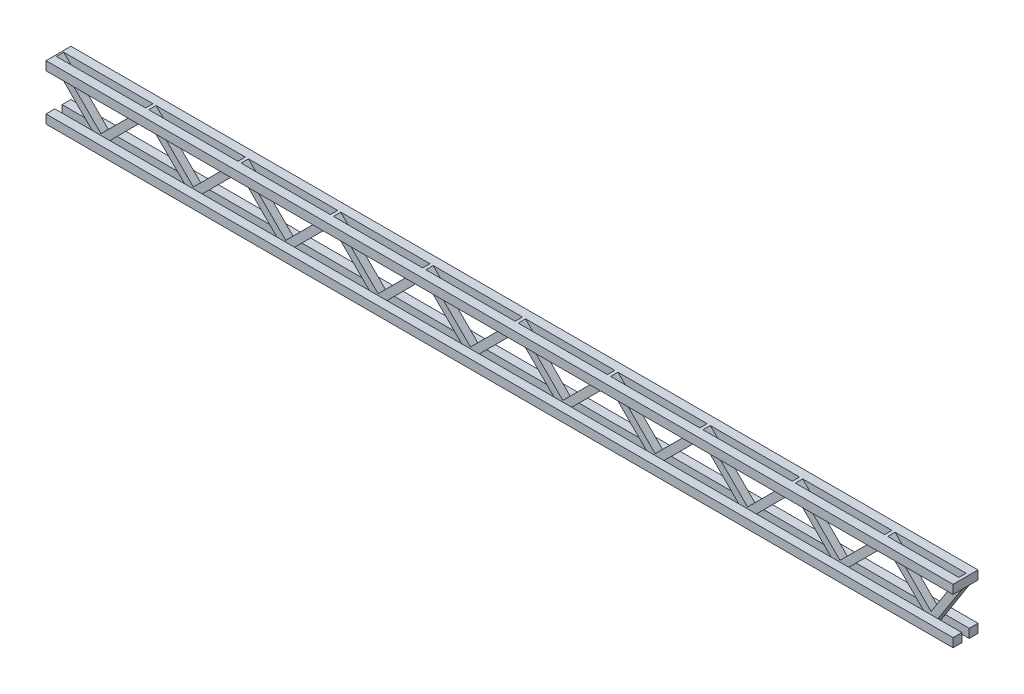
from build123d import *

# Parameters (mm, degrees)
CROQUIS1_W                = 15711.2
CROQUIS1_H                = 152.4
SALIENTE_EXTRUIR1_DEPTH   = 152.4
SALIENTE_EXTRUIR1_2_DEPTH = 152.4
SALIENTE_EXTRUIR4_DEPTH   = 127
CROQUIS6_W                = 15711.2
CROQUIS6_H                = 152.4
SALIENTE_EXTRUIR5_DEPTH   = 152.4


with BuildPart() as part:
    # Croquis1 → Saliente-Extruir1 (new body)
    with BuildSketch(Plane.XY):
        Rectangle(CROQUIS1_W, CROQUIS1_H)
    extrude(amount=SALIENTE_EXTRUIR1_DEPTH)



with BuildPart() as body_2:
    # Croquis1 → Saliente-Extruir1 2 (new body)
    with BuildSketch(Plane.XY):
        with Locations((0, 800)):
            Rectangle(CROQUIS1_W, CROQUIS1_H)
    extrude(amount=SALIENTE_EXTRUIR1_2_DEPTH)


with BuildPart() as part_1:
    add(part.part)

    add(body_2.part)  # Saliente-Extruir4 merges body 2
    # Croquis5 → Saliente-Extruir4 (add)
    with BuildSketch(Plane.XY.offset(152.4)):
        Polygon((7704.88566953, 723.8), (7855.6, 723.8), (7855.6, 876.2), (7802.26926953, 876.2), (7748.582970168, 792.183882063), align=None)
        Polygon((6724.005122421, 723.8), (6544.4, 723.8), (7344.4, -76.2), (7855.6, 723.8), (7704.88566953, 723.8), (7322.467933348, 125.337189073), align=None)
        Polygon((6364.794877579, 723.8), (6544.4, 723.8), (6724.005122421, 723.8), (6571.605122421, 876.2), (6517.194877579, 876.2), align=None)
        Polygon((5124.005122421, 723.8), (4944.4, 723.8), (5744.4, -76.2), (6544.4, 723.8), (6364.794877579, 723.8), (5744.4, 103.405122421), align=None)
        Polygon((4764.794877579, 723.8), (4944.4, 723.8), (5124.005122421, 723.8), (4971.605122421, 876.2), (4917.194877579, 876.2), align=None)
        Polygon((3524.005122421, 723.8), (3344.4, 723.8), (4144.4, -76.2), (4944.4, 723.8), (4764.794877579, 723.8), (4144.4, 103.405122421), align=None)
        Polygon((3164.794877579, 723.8), (3344.4, 723.8), (3524.005122421, 723.8), (3371.605122421, 876.2), (3317.194877579, 876.2), align=None)
        Polygon((1924.005122421, 723.8), (1744.4, 723.8), (2544.4, -76.2), (3344.4, 723.8), (3164.794877579, 723.8), (2544.4, 103.405122421), align=None)
        Polygon((1564.794877579, 723.8), (1744.4, 723.8), (1924.005122421, 723.8), (1771.605122421, 876.2), (1717.194877579, 876.2), align=None)
        Polygon((324.005122421, 723.8), (144.4, 723.8), (944.4, -76.2), (1744.4, 723.8), (1564.794877579, 723.8), (944.4, 103.405122421), align=None)
        Polygon((-35.205122421, 723.8), (144.4, 723.8), (324.005122421, 723.8), (171.605122421, 876.2), (117.194877579, 876.2), align=None)
        Polygon((-1275.994877579, 723.8), (-1455.6, 723.8), (-655.6, -76.2), (144.4, 723.8), (-35.205122421, 723.8), (-655.6, 103.405122421), align=None)
        Polygon((-1635.205122421, 723.8), (-1455.6, 723.8), (-1275.994877579, 723.8), (-1428.394877579, 876.2), (-1482.805122421, 876.2), align=None)
        Polygon((-2875.994877579, 723.8), (-3055.6, 723.8), (-2255.6, -76.2), (-1455.6, 723.8), (-1635.205122421, 723.8), (-2255.6, 103.405122421), align=None)
        Polygon((-3235.205122421, 723.8), (-3055.6, 723.8), (-2875.994877579, 723.8), (-3028.394877579, 876.2), (-3082.805122421, 876.2), align=None)
        Polygon((-4475.994877579, 723.8), (-4655.6, 723.8), (-3855.6, -76.2), (-3055.6, 723.8), (-3235.205122421, 723.8), (-3855.6, 103.405122421), align=None)
        Polygon((-4835.205122421, 723.8), (-4655.6, 723.8), (-4475.994877579, 723.8), (-4628.394877579, 876.2), (-4682.805122421, 876.2), align=None)
        Polygon((-6075.994877579, 723.8), (-6255.6, 723.8), (-5455.6, -76.2), (-4655.6, 723.8), (-4835.205122421, 723.8), (-5455.6, 103.405122421), align=None)
        Polygon((-6435.205122421, 723.8), (-6255.6, 723.8), (-6075.994877579, 723.8), (-6228.394877579, 876.2), (-6282.805122421, 876.2), align=None)
        Polygon((-7675.994877579, 723.8), (-7855.6, 723.8), (-7055.6, -76.2), (-6255.6, 723.8), (-6435.205122421, 723.8), (-7055.6, 103.405122421), align=None)
        Polygon((-7855.6, 876.2), (-7855.6, 723.8), (-7675.994877579, 723.8), (-7765.797438789, 813.602561211), (-7828.394877579, 876.2), align=None)
    extrude(amount=SALIENTE_EXTRUIR4_DEPTH)

    # Croquis6 → Saliente-Extruir5 (add)
    with BuildSketch(Plane.XY.offset(279.4)):
        with Locations((0, 800)):
            Rectangle(CROQUIS6_W, CROQUIS6_H)
        Rectangle(CROQUIS6_W, CROQUIS6_H)
    extrude(amount=SALIENTE_EXTRUIR5_DEPTH)


solid = part_1.part
